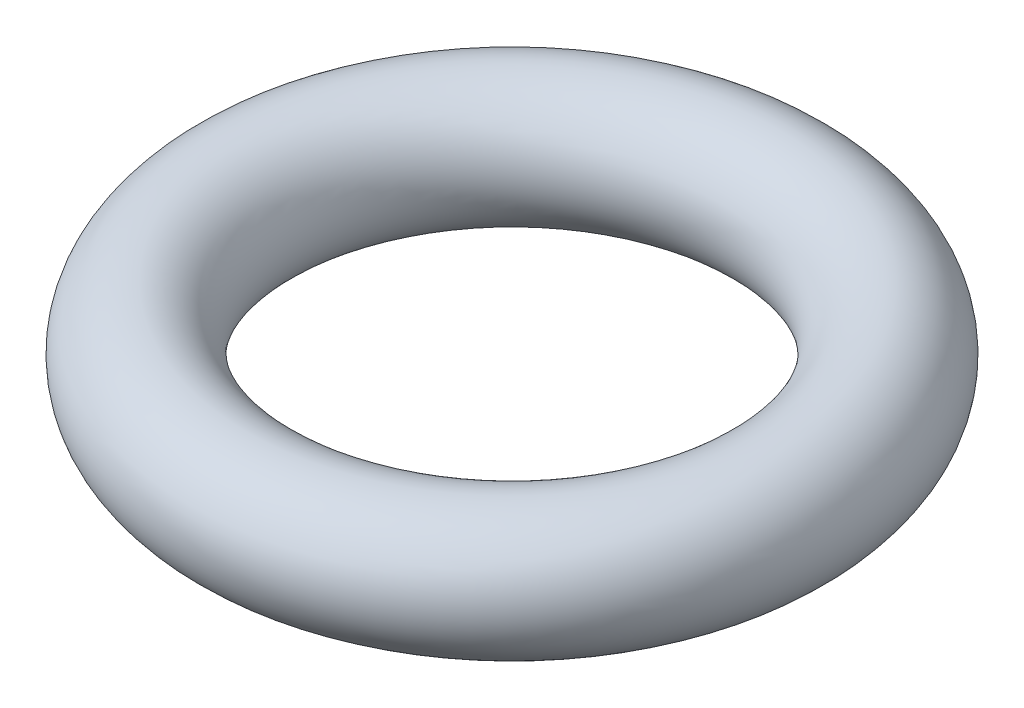
from build123d import *

# Parameters (mm, degrees)
SKETCH1_R = 0.5


with BuildPart() as part:
    # Sketch1 → Revolve1 (revolve)
    with BuildSketch(Plane(origin=(0, 0, 0), x_dir=(0, 0, -1), z_dir=(1, 0, 0))):
        with Locations((2.0878, 0)):
            Circle(SKETCH1_R)
    revolve(axis=Axis((0, 0, 0), (0, 1, 0)))


solid = part.part
